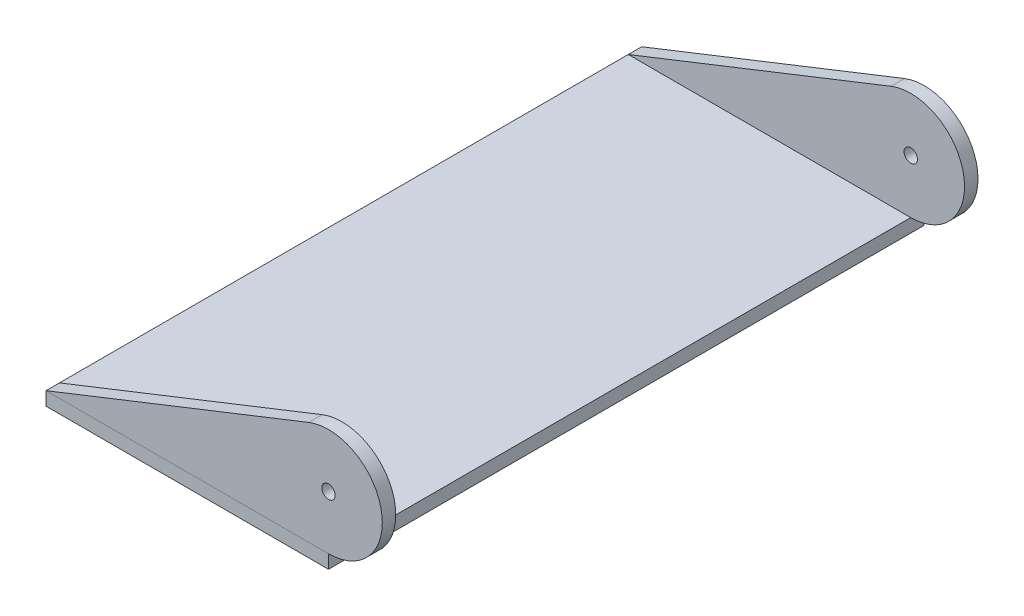
from build123d import *

# Parameters (mm, degrees)
SKETCH1_W           = 33.3375
SKETCH1_H           = 70.3
BOSS_EXTRUDE1_DEPTH = 1.5875
SKETCH3_R           = 0.79375
BOSS_EXTRUDE2_DEPTH = 70.3
SKETCH4_W           = 67.125
SKETCH4_H           = 12.7
CUT_EXTRUDE1_DEPTH  = 82.534117402


with BuildPart() as part:
    # Sketch1 → Boss-Extrude1 (new body)
    with BuildSketch(Plane(origin=(0, 0, 0), x_dir=(1, 0, 0), z_dir=(0, 1, 0))):
        with Locations((16.252975171, -34.625224743)):
            Rectangle(SKETCH1_W, SKETCH1_H)
    extrude(amount=BOSS_EXTRUDE1_DEPTH)


with BuildPart() as body_2:
    # Sketch3 → Boss-Extrude2 (new body)
    with BuildSketch(Plane.XY.offset(69.775224743)):
        with BuildLine():
            Line((30.587370685, 13.84286105), (-0.415774829, 1.5875))
            Line((-0.415774829, 1.5875), (32.921725171, 1.5875))
            ThreePointArc((32.921725171, 1.5875), (39.159575068, 9.125661885), (30.587370685, 13.84286105))
        make_face()
        with Locations((32.921725171, 7.9375)):
            Circle(SKETCH3_R, mode=Mode.SUBTRACT)
    extrude(amount=-BOSS_EXTRUDE2_DEPTH)

    # Sketch4 → Cut-Extrude1 (cut, through all)
    with BuildSketch(Plane.ZY.offset(0.415774829)):
        with Locations((34.625224743, 7.9375)):
            Rectangle(SKETCH4_W, SKETCH4_H)
    extrude(amount=-CUT_EXTRUDE1_DEPTH, mode=Mode.SUBTRACT)


with BuildPart() as cut_extrude1_piece_1:
    # of the separate pieces the step leaves, piece 1, a body of its own (cut_extrude1_pieces)
    add(body_2.part.solids().sort_by_distance((32.921725171, 1.5875, 69.775224743))[0])


with BuildPart() as cut_extrude1_piece_2:
    # of the separate pieces the step leaves, piece 2, a body of its own (cut_extrude1_pieces)
    add(body_2.part.solids().sort_by_distance((30.587370685, 13.84286105, 1.062724743))[0])


solid = Compound([part.part, cut_extrude1_piece_1.part, cut_extrude1_piece_2.part])
